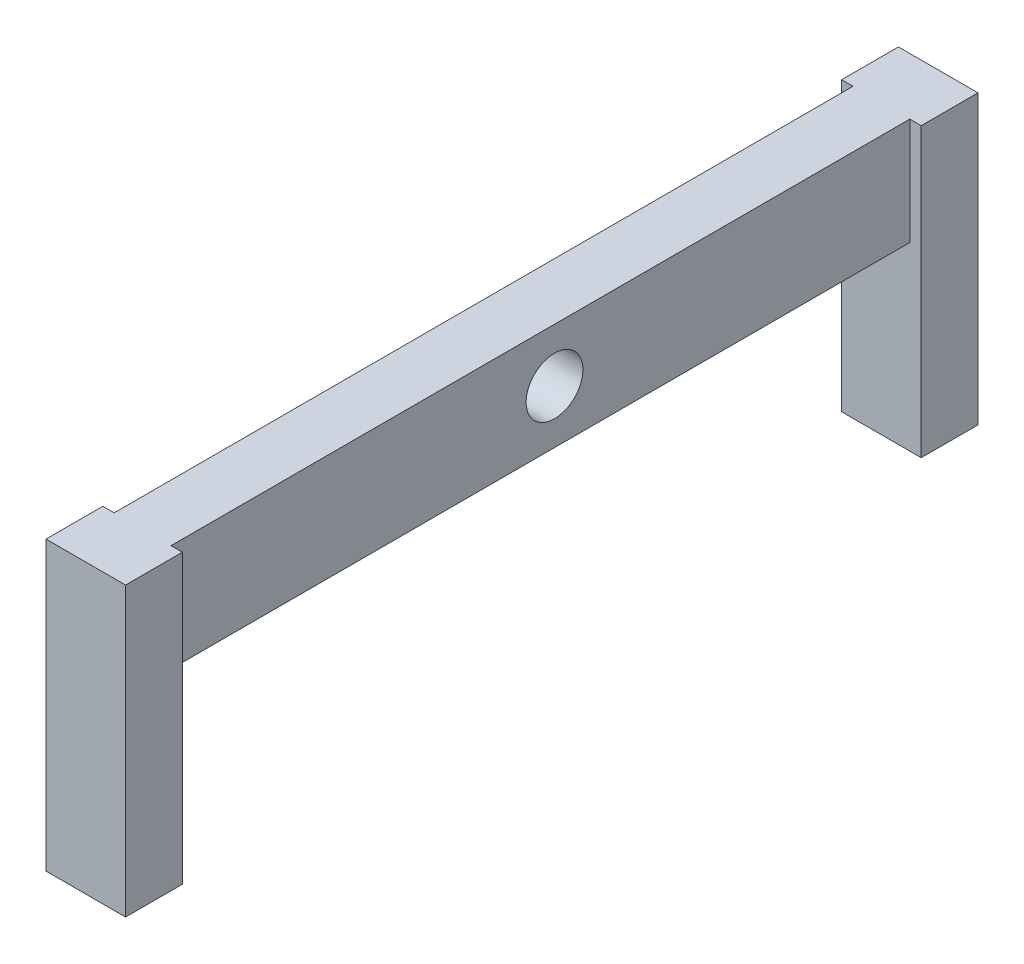
from build123d import *

# Parameters (mm, degrees)
SKETCH1_W               = 50
SKETCH1_H               = 750
BOSS_EXTRUDE1_DEPTH     = 94
SKETCH2_W               = 70
SKETCH2_H               = 50
BOSS_EXTRUDE2_DEPTH     = 253
SKETCH3_R               = 20
CUT_EXTRUDE1_DEPTH      = 10
CUT_EXTRUDE2_DEPTH      = 537.465549172
CUT_EXTRUDE2_DEPTH_BACK = 537.465549172
SKETCH4_R               = 25


with BuildPart() as part:
    # Sketch1 → Boss-Extrude1 (new body)
    with BuildSketch(Plane(origin=(0, 0, 0), x_dir=(1, 0, 0), z_dir=(0, 1, 0))):
        with Locations((-449.137931034, -133.836206897)):
            Rectangle(SKETCH1_W, SKETCH1_H)
    extrude(amount=BOSS_EXTRUDE1_DEPTH)

    # Sketch2 → Boss-Extrude2 (add)
    with BuildSketch(Plane(origin=(0, 94, 0), x_dir=(1, 0, 0), z_dir=(0, 1, 0))):
        with Locations((-449.137931034, 216.163793103)):
            Rectangle(SKETCH2_W, SKETCH2_H)
        with Locations((-449.137931034, -483.836206897)):
            Rectangle(SKETCH2_W, SKETCH2_H)
    extrude(amount=-BOSS_EXTRUDE2_DEPTH)

    # Sketch3 → Cut-Extrude1 (cut)
    with BuildSketch(Plane.ZY.offset(474.137931034)):
        with Locations((-137.663793103, 47)):
            Circle(SKETCH3_R)
        with Locations((405.336206897, 47)):
            Circle(SKETCH3_R)
    extrude(amount=-CUT_EXTRUDE1_DEPTH, mode=Mode.SUBTRACT)

    # Sketch4 → Cut-Extrude2 (cut, two sides: drawn at the far end of the back side and taken through both)
    with BuildSketch(Plane(origin=(-424.137931034, 0, 0), x_dir=(0, 0, -1), z_dir=(1, 0, 0)).offset(-CUT_EXTRUDE2_DEPTH_BACK)):
        with Locations((-121.436206897, 47)):
            Circle(SKETCH4_R)
    extrude(amount=CUT_EXTRUDE2_DEPTH + CUT_EXTRUDE2_DEPTH_BACK, mode=Mode.SUBTRACT)


solid = part.part
